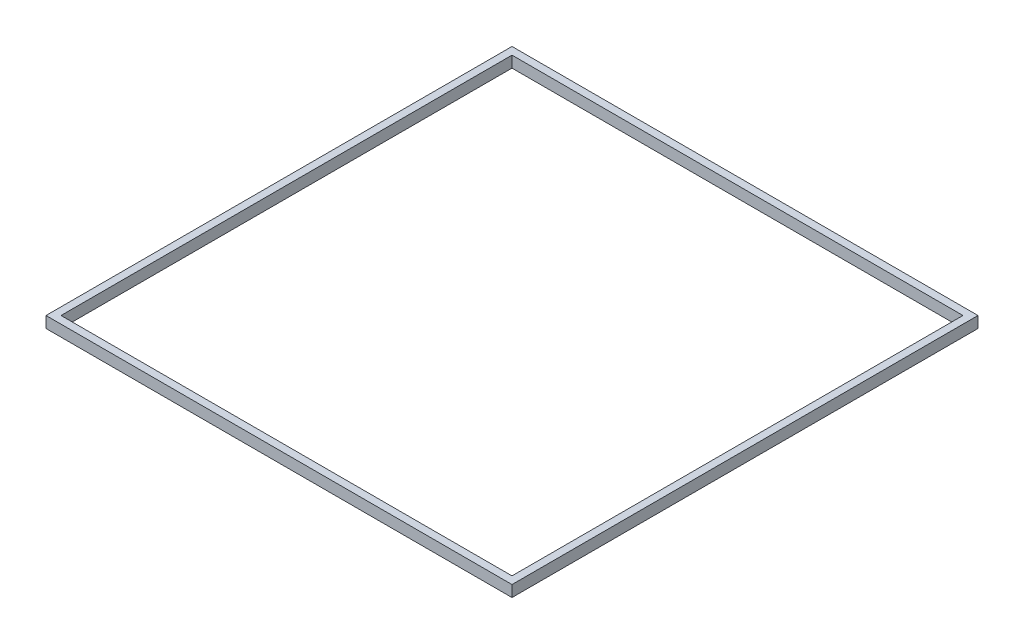
from build123d import *

# Parameters (mm, degrees)
SKETCH1_W           = 1240
SKETCH1_H           = 1240
SKETCH1_W_2         = 1200
SKETCH1_H_2         = 1200
BOSS_EXTRUDE1_DEPTH = 15


with BuildPart() as part:
    # Sketch1 → Boss-Extrude1 (new, symmetric)
    with BuildSketch(Plane(origin=(0, 0, 0), x_dir=(1, 0, 0), z_dir=(0, 1, 0))):
        Rectangle(SKETCH1_W, SKETCH1_H)
        Rectangle(SKETCH1_W_2, SKETCH1_H_2, mode=Mode.SUBTRACT)
    extrude(amount=BOSS_EXTRUDE1_DEPTH, both=True)


solid = part.part
